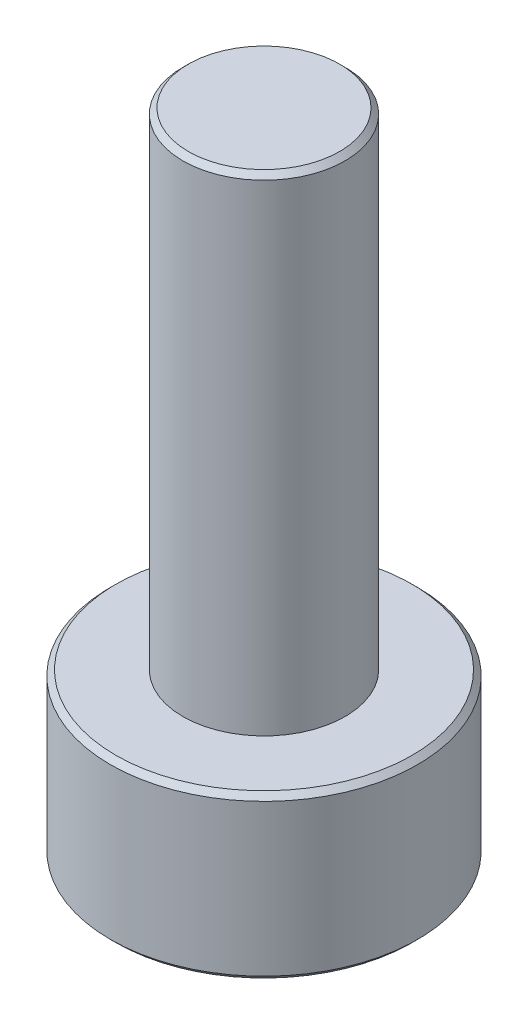
from build123d import *

# Parameters (mm, degrees)
SKETCH_1_R            = 2.84
EXTRUDE_261_DEPTH     = 3
SKETCH_2_R            = 1.5
EXTRUDE_345_DEPTH     = 9
CUT_EXTRUDE_529_DEPTH = 1.3
CHAMFER_591_SIZE      = 0.1


with BuildPart() as part:
    # 草图1 → Extrude 261 (new body)
    with BuildSketch(Plane(origin=(0, 0, 0), x_dir=(1, 0, 0), z_dir=(0, 1, 0))):
        with Locations(Location((0, 0, 0), (0, 0, 270))):
            Circle(SKETCH_1_R)
    extrude(amount=EXTRUDE_261_DEPTH)

    # 草图2 → Extrude 345 (add)
    with BuildSketch(Plane(origin=(0, 3, 0), x_dir=(1, 0, 0), z_dir=(0, 1, 0))):
        with Locations(Location((0, 0, 0), (0, 0, 270))):
            Circle(SKETCH_2_R)
    extrude(amount=EXTRUDE_345_DEPTH)

    # 草图3 → Cut-Extrude 529 (cut)
    with BuildSketch(Plane.XZ):
        Polygon((1.29, -0.744781847), (1.29, 0.744781847), (0, 1.489563695), (-1.29, 0.744781847), (-1.29, -0.744781847), (0, -1.489563695), align=None)
    extrude(amount=-CUT_EXTRUDE_529_DEPTH, mode=Mode.SUBTRACT)

    # Chamfer 591
    chamfer_591_edges = [part.edges().sort_by_distance(p)[0] for p in [
        (0, 0, -2.84),
        (0, 3, -2.84),
        (0, 12, -1.5),
    ]]
    chamfer(chamfer_591_edges, length=CHAMFER_591_SIZE)


solid = part.part
